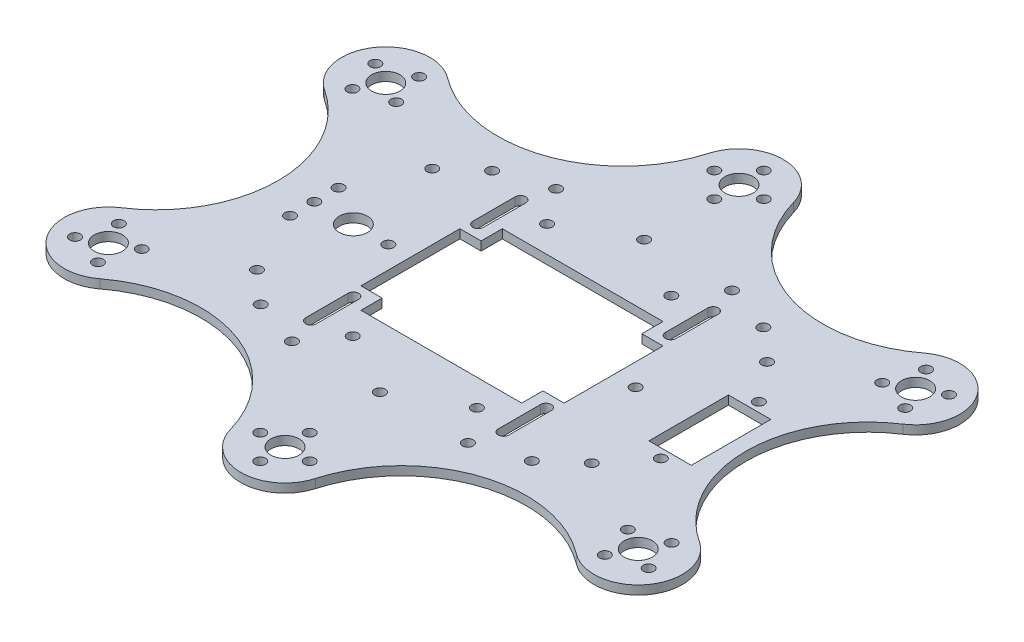
from build123d import *

# Parameters (mm, degrees)
SKETCH1_R           = 4
SKETCH1_R_2         = 1.5
SKETCH1_W           = 12
SKETCH1_H           = 22.5
BOSS_EXTRUDE1_DEPTH = 2.5


with BuildPart() as part:
    # Sketch1 → Boss-Extrude1 (new body)
    with BuildSketch(Plane(origin=(0, 0, 0), x_dir=(1, 0, 0), z_dir=(0, 1, 0))):
        with BuildLine():
            ThreePointArc((12.022120265, 67.673247628), (0, 76.75), (-12.022120265, 67.673247628))
            ThreePointArc((-12.022120265, 67.673247628), (-34.842613641, 43.81538777), (-67.414732932, 49.203285306))
            ThreePointArc((-67.414732932, 49.203285306), (-85.189938198, 46.45680917), (-81.819417269, 28.789306741))
            ThreePointArc((-81.819417269, 28.789306741), (-66.25, 0), (-81.819417269, -28.789306741))
            ThreePointArc((-81.819417269, -28.789306741), (-85.189938198, -46.45680917), (-67.414732932, -49.203285306))
            ThreePointArc((-67.414732932, -49.203285306), (-34.842613641, -43.81538777), (-12.022120265, -67.673247628))
            ThreePointArc((-12.022120265, -67.673247628), (0, -76.75), (12.022120265, -67.673247628))
            ThreePointArc((12.022120265, -67.673247628), (34.842613641, -43.81538777), (67.414732932, -49.203285306))
            ThreePointArc((67.414732932, -49.203285306), (85.189938198, -46.45680917), (81.819417269, -28.789306741))
            ThreePointArc((81.819417269, -28.789306741), (66.25, 0), (81.819417269, 28.789306741))
            ThreePointArc((81.819417269, 28.789306741), (85.189938198, 46.45680917), (67.414732932, 49.203285306))
            ThreePointArc((67.414732932, 49.203285306), (34.842613641, 43.81538777), (12.022120265, 67.673247628))
        make_face()
        with Locations(Location((0, 64.25, 0), (0, 0, 270))):
            Circle(SKETCH1_R, mode=Mode.SUBTRACT)
        with Locations(Location((-7, 64.25, 0), (0, 0, 270))):
            Circle(SKETCH1_R_2, mode=Mode.SUBTRACT)
        with Locations(Location((0, 57.25, 0), (0, 0, 270))):
            Circle(SKETCH1_R_2, mode=Mode.SUBTRACT)
        with Locations(Location((7, 64.25, 0), (0, 0, 270))):
            Circle(SKETCH1_R_2, mode=Mode.SUBTRACT)
        with Locations(Location((0, 71.25, 0), (0, 0, 270))):
            Circle(SKETCH1_R_2, mode=Mode.SUBTRACT)
        with Locations(Location((0, 37.375, 0), (0, 0, 270))):
            Circle(SKETCH1_R_2, mode=Mode.SUBTRACT)
        with Locations(Location((17.575, 27.5, 0), (0, 0, 270))):
            Circle(SKETCH1_R_2, mode=Mode.SUBTRACT)
        with Locations(Location((24.9, 37.375, 0), (0, 0, 270))):
            Circle(SKETCH1_R_2, mode=Mode.SUBTRACT)
        with Locations(Location((38.375, 32.75, 0), (0, 0, 270))):
            Circle(SKETCH1_R_2, mode=Mode.SUBTRACT)
        with Locations(Location((47.375, 24.800648389, 0), (0, 0, 270))):
            Circle(SKETCH1_R_2, mode=Mode.SUBTRACT)
        with Locations(Location((74.976618386, 39.25, 0), (0, 0, 270))):
            Circle(SKETCH1_R, mode=Mode.SUBTRACT)
        with Locations(Location((68.775, 36.003474258, 0), (0, 0, 270))):
            Circle(SKETCH1_R_2, mode=Mode.SUBTRACT)
        with Locations(Location((71.730092644, 45.451618386, 0), (0, 0, 270))):
            Circle(SKETCH1_R_2, mode=Mode.SUBTRACT)
        with Locations(Location((81.178236772, 42.496525742, 0), (0, 0, 270))):
            Circle(SKETCH1_R_2, mode=Mode.SUBTRACT)
        with Locations(Location((78.223144128, 33.048381614, 0), (0, 0, 270))):
            Circle(SKETCH1_R_2, mode=Mode.SUBTRACT)
        with Locations(Location((35, 0, 0), (0, 0, 270))):
            Circle(SKETCH1_R_2, mode=Mode.SUBTRACT)
        with Locations(Location((-35, 0, 0), (0, 0, 270))):
            Circle(SKETCH1_R_2, mode=Mode.SUBTRACT)
        with Locations(Location((-47.375, 24.800648389, 0), (0, 0, 270))):
            Circle(SKETCH1_R_2, mode=Mode.SUBTRACT)
        with Locations(Location((-38.375, 32.75, 0), (0, 0, 270))):
            Circle(SKETCH1_R_2, mode=Mode.SUBTRACT)
        with Locations(Location((-17.575, 27.5, 0), (0, 0, 270))):
            Circle(SKETCH1_R_2, mode=Mode.SUBTRACT)
        with Locations(Location((-24.9, 37.375, 0), (0, 0, 270))):
            Circle(SKETCH1_R_2, mode=Mode.SUBTRACT)
        with Locations(Location((-78.223144128, 33.048381614, 0), (0, 0, 270))):
            Circle(SKETCH1_R_2, mode=Mode.SUBTRACT)
        with Locations(Location((-81.178236772, 42.496525742, 0), (0, 0, 270))):
            Circle(SKETCH1_R_2, mode=Mode.SUBTRACT)
        with Locations(Location((-71.730092644, 45.451618386, 0), (0, 0, 270))):
            Circle(SKETCH1_R_2, mode=Mode.SUBTRACT)
        with Locations(Location((-68.775, 36.003474258, 0), (0, 0, 270))):
            Circle(SKETCH1_R_2, mode=Mode.SUBTRACT)
        with Locations(Location((-74.976618386, 39.25, 0), (0, 0, 270))):
            Circle(SKETCH1_R, mode=Mode.SUBTRACT)
        with Locations(Location((-24.9, -37.375, 0), (0, 0, 270))):
            Circle(SKETCH1_R_2, mode=Mode.SUBTRACT)
        with Locations(Location((-17.575, -27.5, 0), (0, 0, 270))):
            Circle(SKETCH1_R_2, mode=Mode.SUBTRACT)
        with Locations(Location((-38.375, -32.75, 0), (0, 0, 270))):
            Circle(SKETCH1_R_2, mode=Mode.SUBTRACT)
        with Locations(Location((-47.375, -24.800648389, 0), (0, 0, 270))):
            Circle(SKETCH1_R_2, mode=Mode.SUBTRACT)
        with Locations(Location((47.375, -24.800648389, 0), (0, 0, 270))):
            Circle(SKETCH1_R_2, mode=Mode.SUBTRACT)
        with Locations(Location((38.375, -32.75, 0), (0, 0, 270))):
            Circle(SKETCH1_R_2, mode=Mode.SUBTRACT)
        with Locations(Location((24.9, -37.375, 0), (0, 0, 270))):
            Circle(SKETCH1_R_2, mode=Mode.SUBTRACT)
        with Locations(Location((17.575, -27.5, 0), (0, 0, 270))):
            Circle(SKETCH1_R_2, mode=Mode.SUBTRACT)
        with Locations(Location((0, -37.375, 0), (0, 0, 270))):
            Circle(SKETCH1_R_2, mode=Mode.SUBTRACT)
        with Locations(Location((0, -71.25, 0), (0, 0, 270))):
            Circle(SKETCH1_R_2, mode=Mode.SUBTRACT)
        with Locations(Location((7, -64.25, 0), (0, 0, 270))):
            Circle(SKETCH1_R_2, mode=Mode.SUBTRACT)
        with Locations(Location((0, -57.25, 0), (0, 0, 270))):
            Circle(SKETCH1_R_2, mode=Mode.SUBTRACT)
        with Locations(Location((-7, -64.25, 0), (0, 0, 270))):
            Circle(SKETCH1_R_2, mode=Mode.SUBTRACT)
        with Locations(Location((0, -64.25, 0), (0, 0, 270))):
            Circle(SKETCH1_R, mode=Mode.SUBTRACT)
        with Locations(Location((78.223144128, -33.048381614, 0), (0, 0, 270))):
            Circle(SKETCH1_R_2, mode=Mode.SUBTRACT)
        with Locations(Location((81.178236772, -42.496525742, 0), (0, 0, 270))):
            Circle(SKETCH1_R_2, mode=Mode.SUBTRACT)
        with Locations(Location((71.730092644, -45.451618386, 0), (0, 0, 270))):
            Circle(SKETCH1_R_2, mode=Mode.SUBTRACT)
        with Locations(Location((68.775, -36.003474258, 0), (0, 0, 270))):
            Circle(SKETCH1_R_2, mode=Mode.SUBTRACT)
        with Locations(Location((74.976618386, -39.25, 0), (0, 0, 270))):
            Circle(SKETCH1_R, mode=Mode.SUBTRACT)
        with Locations(Location((-74.976618386, -39.25, 0), (0, 0, 270))):
            Circle(SKETCH1_R, mode=Mode.SUBTRACT)
        with Locations(Location((-68.775, -36.003474258, 0), (0, 0, 270))):
            Circle(SKETCH1_R_2, mode=Mode.SUBTRACT)
        with Locations(Location((-71.730092644, -45.451618386, 0), (0, 0, 270))):
            Circle(SKETCH1_R_2, mode=Mode.SUBTRACT)
        with Locations(Location((-81.178236772, -42.496525742, 0), (0, 0, 270))):
            Circle(SKETCH1_R_2, mode=Mode.SUBTRACT)
        with Locations(Location((-78.223144128, -33.048381614, 0), (0, 0, 270))):
            Circle(SKETCH1_R_2, mode=Mode.SUBTRACT)
        with Locations(Location((56, 13.875, 0), (0, 0, 270))):
            Circle(SKETCH1_R_2, mode=Mode.SUBTRACT)
        with Locations(Location((56, -13.875, 0), (0, 0, 270))):
            Circle(SKETCH1_R_2, mode=Mode.SUBTRACT)
        with Locations(Location((-44.9, 0, 0), (0, 0, 270))):
            Circle(SKETCH1_R, mode=Mode.SUBTRACT)
        with Locations(Location((-55.95, 0, 0), (0, 0, 270))):
            Circle(SKETCH1_R_2, mode=Mode.SUBTRACT)
        with Locations(Location((-55.95, 6.875, 0), (0, 0, 270))):
            Circle(SKETCH1_R_2, mode=Mode.SUBTRACT)
        with Locations(Location((-55.95, -6.875, 0), (0, 0, 270))):
            Circle(SKETCH1_R_2, mode=Mode.SUBTRACT)
        with BuildLine():
            Line((25.75, 17.65), (25.75, 29.65))
            ThreePointArc((25.75, 29.65), (27.25, 31.15), (28.75, 29.65))
            Line((28.75, 29.65), (28.75, 17.65))
            ThreePointArc((28.75, 17.65), (27.25, 16.15), (25.75, 17.65))
        make_face(mode=Mode.SUBTRACT)
        Polygon((-22.75, 20), (-22.75, 14), (-28.75, 14), (-28.75, -14), (-22.75, -14), (-22.75, -20), (22.75, -20), (22.75, -14), (28.75, -14), (28.75, 14), (22.75, 14), (22.75, 20), align=None, mode=Mode.SUBTRACT)
        with BuildLine():
            Line((-25.75, 17.65), (-25.75, 29.65))
            ThreePointArc((-25.75, 29.65), (-27.25, 31.15), (-28.75, 29.65))
            Line((-28.75, 29.65), (-28.75, 17.65))
            ThreePointArc((-28.75, 17.65), (-27.25, 16.15), (-25.75, 17.65))
        make_face(mode=Mode.SUBTRACT)
        with BuildLine():
            Line((-25.75, -17.65), (-25.75, -29.65))
            ThreePointArc((-25.75, -29.65), (-27.25, -31.15), (-28.75, -29.65))
            Line((-28.75, -29.65), (-28.75, -17.65))
            ThreePointArc((-28.75, -17.65), (-27.25, -16.15), (-25.75, -17.65))
        make_face(mode=Mode.SUBTRACT)
        with BuildLine():
            Line((25.75, -17.65), (25.75, -29.65))
            ThreePointArc((25.75, -29.65), (27.25, -31.15), (28.75, -29.65))
            Line((28.75, -29.65), (28.75, -17.65))
            ThreePointArc((28.75, -17.65), (27.25, -16.15), (25.75, -17.65))
        make_face(mode=Mode.SUBTRACT)
        with Locations((56, 0)):
            Rectangle(SKETCH1_W, SKETCH1_H, mode=Mode.SUBTRACT)
    extrude(amount=BOSS_EXTRUDE1_DEPTH)


solid = part.part
